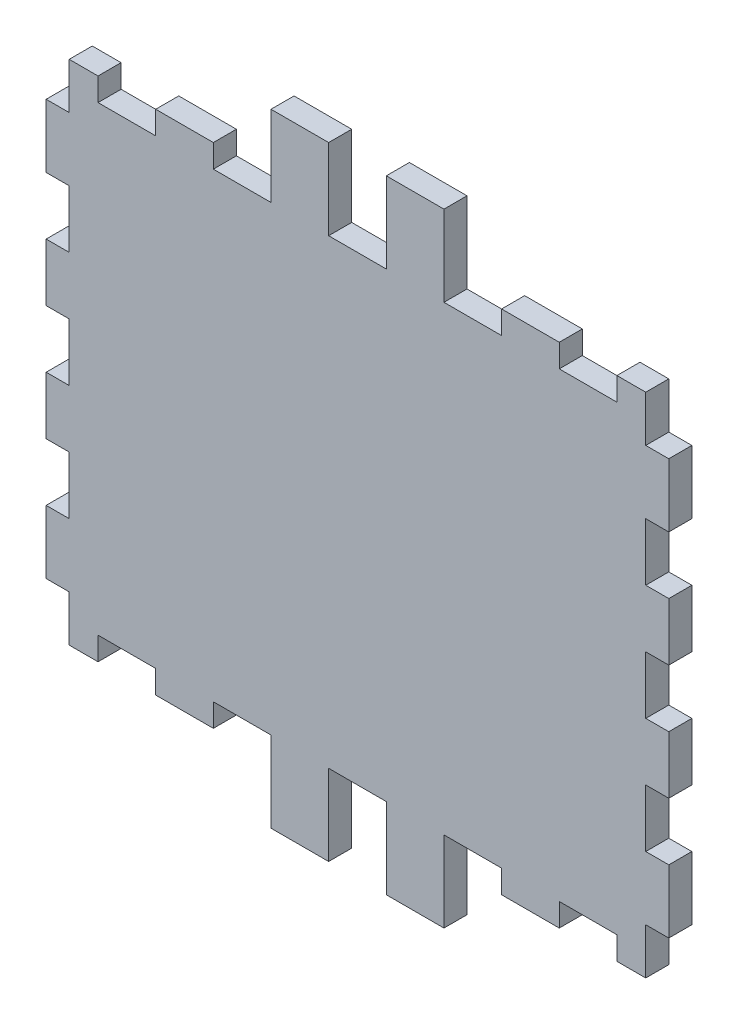
from build123d import *

# Parameters (mm, degrees)
SKETCH1_W           = 5
SKETCH1_H           = 4
SKETCH1_W_2         = 4
SKETCH1_H_2         = 10
SKETCH1_W_3         = 10
BOSS_EXTRUDE1_DEPTH = 4
SKETCH2_W           = 4
SKETCH2_H           = 1
BOSS_EXTRUDE2_DEPTH = 4


with BuildPart() as part:
    # Sketch1 → Boss-Extrude1 (new body)
    with BuildSketch(Plane.XY):
        with Locations((-47.5, 42)):
            Rectangle(SKETCH1_W, SKETCH1_H)
        Polygon((-45, 40), (-50, 40), (-50, 35), (-46, 35), (-46, 25), (-50, 25), (-50, 20), (-50, 15), (-46, 15), (-46, 5), (-50, 5), (-50, 0), (-50, -5), (-46, -5), (-46, -15), (-50, -15), (-50, -20), (-50, -25), (-46, -25), (-46, -35), (-50, -35), (-50, -40), (-45, -40), (-40, -40), (-35, -40), (-30, -40), (-25, -40), (-20, -40), (-15, -40), (-10, -40), (-5, -40), (0, -40), (5, -40), (10, -40), (15, -40), (20, -40), (25, -40), (30, -40), (35, -40), (40, -40), (45, -40), (50, -40), (50, -35), (46, -35), (46, -25), (50, -25), (50, -20), (50, -15), (46, -15), (46, -5), (50, -5), (50, 0), (50, 5), (46, 5), (46, 15), (50, 15), (50, 20), (50, 25), (46, 25), (46, 35), (50, 35), (50, 40), (45, 40), (40, 40), (35, 40), (30, 40), (25, 40), (20, 40), (15, 40), (10, 40), (5, 40), (0, 40), (-5, 40), (-10, 40), (-15, 40), (-20, 40), (-25, 40), (-30, 40), (-35, 40), (-40, 40), align=None)
        with Locations((-48, 30)):
            Rectangle(SKETCH1_W_2, SKETCH1_H_2)
        with Locations((-52, 30)):
            Rectangle(SKETCH1_W_2, SKETCH1_H_2)
        Polygon((-35, 44), (-35, 40), (-30, 40), (-25, 40), (-25, 44), align=None)
        with Locations((-48, 10)):
            Rectangle(SKETCH1_W_2, SKETCH1_H_2)
        with Locations((-52, 10)):
            Rectangle(SKETCH1_W_2, SKETCH1_H_2)
        Polygon((-15, 44), (-15, 40), (-10, 40), (-5, 40), (-5, 44), align=None)
        with Locations((-48, -10)):
            Rectangle(SKETCH1_W_2, SKETCH1_H_2)
        with Locations((-52, -10)):
            Rectangle(SKETCH1_W_2, SKETCH1_H_2)
        with Locations((-10, 49)):
            Rectangle(SKETCH1_W_3, SKETCH1_H_2)
        with Locations((-48, -30)):
            Rectangle(SKETCH1_W_2, SKETCH1_H_2)
        with Locations((-52, -30)):
            Rectangle(SKETCH1_W_2, SKETCH1_H_2)
        Polygon((5, 44), (5, 40), (10, 40), (15, 40), (15, 44), align=None)
        with Locations((10, 49)):
            Rectangle(SKETCH1_W_3, SKETCH1_H_2)
        with Locations((-47.5, -42)):
            Rectangle(SKETCH1_W, SKETCH1_H)
        Polygon((25, 44), (25, 40), (30, 40), (35, 40), (35, 44), align=None)
        Polygon((-30, -40), (-35, -40), (-35, -44), (-25, -44), (-25, -40), align=None)
        with Locations((47.5, 42)):
            Rectangle(SKETCH1_W, SKETCH1_H)
        Polygon((-10, -40), (-15, -40), (-15, -44), (-5, -44), (-5, -40), align=None)
        with Locations((-10, -49)):
            Rectangle(SKETCH1_W_3, SKETCH1_H_2)
        with Locations((52, 30)):
            Rectangle(SKETCH1_W_2, SKETCH1_H_2)
        with Locations((48, 30)):
            Rectangle(SKETCH1_W_2, SKETCH1_H_2)
        Polygon((10, -40), (5, -40), (5, -44), (15, -44), (15, -40), align=None)
        with Locations((52, 10)):
            Rectangle(SKETCH1_W_2, SKETCH1_H_2)
        with Locations((48, 10)):
            Rectangle(SKETCH1_W_2, SKETCH1_H_2)
        with Locations((10, -49)):
            Rectangle(SKETCH1_W_3, SKETCH1_H_2)
        with Locations((52, -10)):
            Rectangle(SKETCH1_W_2, SKETCH1_H_2)
        with Locations((48, -10)):
            Rectangle(SKETCH1_W_2, SKETCH1_H_2)
        Polygon((30, -40), (25, -40), (25, -44), (35, -44), (35, -40), align=None)
        with Locations((52, -30)):
            Rectangle(SKETCH1_W_2, SKETCH1_H_2)
        with Locations((48, -30)):
            Rectangle(SKETCH1_W_2, SKETCH1_H_2)
        with Locations((47.5, -42)):
            Rectangle(SKETCH1_W, SKETCH1_H)
    extrude(amount=BOSS_EXTRUDE1_DEPTH)

    # Sketch2 → Boss-Extrude2 (add)
    with BuildSketch(Plane.XY.offset(4)):
        with Locations((52, -35.5)):
            Rectangle(SKETCH2_W, SKETCH2_H)
        with Locations((52, 35.5)):
            Rectangle(SKETCH2_W, SKETCH2_H)
        with Locations((-52, -35.5)):
            Rectangle(SKETCH2_W, SKETCH2_H)
        with Locations((-52, 35.5)):
            Rectangle(SKETCH2_W, SKETCH2_H)
    extrude(amount=-BOSS_EXTRUDE2_DEPTH)


solid = part.part
